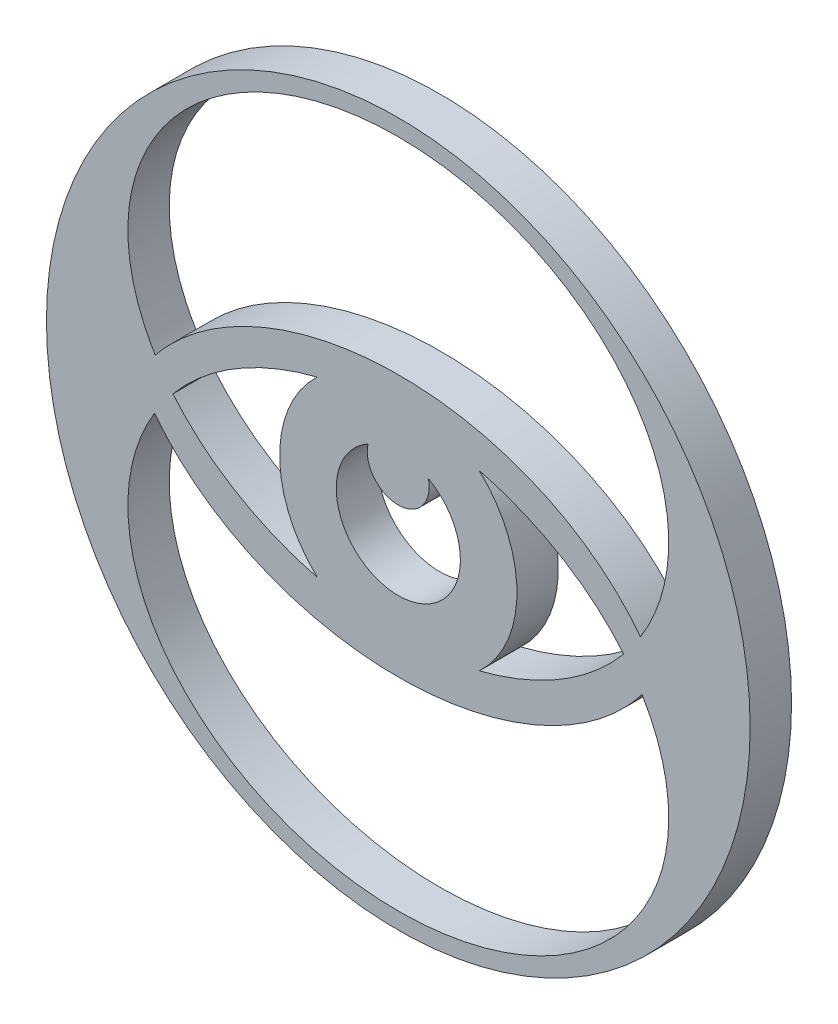
from build123d import *

# Parameters (mm, degrees)
SKETCH_1_R      = 255.007073506
EXTRUDE_1_DEPTH = 30


with BuildPart() as part:
    # Эскиз1 → Бобышка-Вытянуть1 (new body)
    with BuildSketch(Plane.XY):
        Circle(SKETCH_1_R)
        with BuildLine():
            add(Edge.make_bspline(
                [(-176.723140988, -18.818560865), (-282.928296502, -195.620073949), (-43.464148251, -239.103497414), (196, -282.58692088), (196, -86.5)],
                knots=[2.694363064, 2.694363064, 2.694363064, 4.488774186, 4.488774186, 6.283185307, 6.283185307, 6.283185307], degree=2, weights=[1, 0.623796498, 1, 0.623796498, 1]))
            add(Edge.make_bspline(
                [(-176.723140988, -18.818560865), (0.091215786, -248.766222331), (176.655344593, -18.70581462)],
                knots=[3.673803124, 3.673803124, 3.673803124, 5.751808031, 5.751808031, 5.751808031], degree=2, weights=[1, 0.507080293, 1]))
            add(Edge.make_bspline(
                [(196, -86.5), (196, -50.843298634), (176.655344593, -18.70581462)],
                knots=[0, 0, 0, 0.448028749, 0.448028749, 0.448028749], degree=2, weights=[1, 0.975013533, 1]))
        make_face(mode=Mode.SUBTRACT)
        with BuildLine():
            add(Edge.make_bspline(
                [(175.499994085, 16.818952725), (285.643752257, 193.682718887), (44.821876129, 238.852896014), (-196, 284.02307314), (-196, 86.5)],
                knots=[2.680143332, 2.680143332, 2.680143332, 4.48166432, 4.48166432, 6.283185307, 6.283185307, 6.283185307], degree=2, weights=[1, 0.621014073, 1, 0.621014073, 1]))
            add(Edge.make_bspline(
                [(175.499994085, 16.818952725), (5.708014638, 242.49666802), (-176.156401015, 17.883077152)],
                knots=[3.636825053, 3.636825053, 3.636825053, 5.699736109, 5.699736109, 5.699736109], degree=2, weights=[1, 0.513570478, 1]))
            add(Edge.make_bspline(
                [(-196, 86.5), (-196, 50.362191161), (-176.156401015, 17.883077152)],
                knots=[0, 0, 0, 0.45386977, 0.45386977, 0.45386977], degree=2, weights=[1, 0.974360598, 1]))
        make_face(mode=Mode.SUBTRACT)
        with BuildLine():
            add(Edge.make_bspline(
                [(58.751055362, -62.803769743), (124.97390961, -46.189956075), (163.34050211, 0)],
                knots=[1.875227216, 1.875227216, 1.875227216, 2.555973281, 2.555973281, 2.555973281], degree=2, weights=[1, 0.942630199, 1]))
            ThreePointArc((58.751055362, -62.803769743), (86, 0), (58.751055362, 62.803769743))
            add(Edge.make_bspline(
                [(163.34050211, 0), (124.97390961, 46.189956075), (58.751055362, 62.803769743)],
                knots=[0.585619373, 0.585619373, 0.585619373, 1.266365437, 1.266365437, 1.266365437], degree=2, weights=[1, 0.942630199, 1]))
        make_face(mode=Mode.SUBTRACT)
        with BuildLine():
            add(Edge.make_bspline(
                [(-163.34050211, 0), (-124.97390961, -46.189956075), (-58.751055362, -62.803769743)],
                knots=[0.585619373, 0.585619373, 0.585619373, 1.266365437, 1.266365437, 1.266365437], degree=2, weights=[1, 0.942630199, 1]))
            add(Edge.make_bspline(
                [(-58.751055362, 62.803769743), (-124.97390961, 46.189956075), (-163.34050211, 0)],
                knots=[1.875227216, 1.875227216, 1.875227216, 2.555973281, 2.555973281, 2.555973281], degree=2, weights=[1, 0.942630199, 1]))
            ThreePointArc((-58.751055362, 62.803769743), (-86, 0), (-58.751055362, -62.803769743))
        make_face(mode=Mode.SUBTRACT)
        with BuildLine():
            ThreePointArc((21.769202582, 39.384029999), (0.101382097, -44.999885796), (-21.946440501, 39.285541225))
            ThreePointArc((-21.946440501, 39.285541225), (-0.026653996, 11.830755357), (21.769202582, 39.384029999))
        make_face(mode=Mode.SUBTRACT)
    extrude(amount=EXTRUDE_1_DEPTH)


solid = part.part
